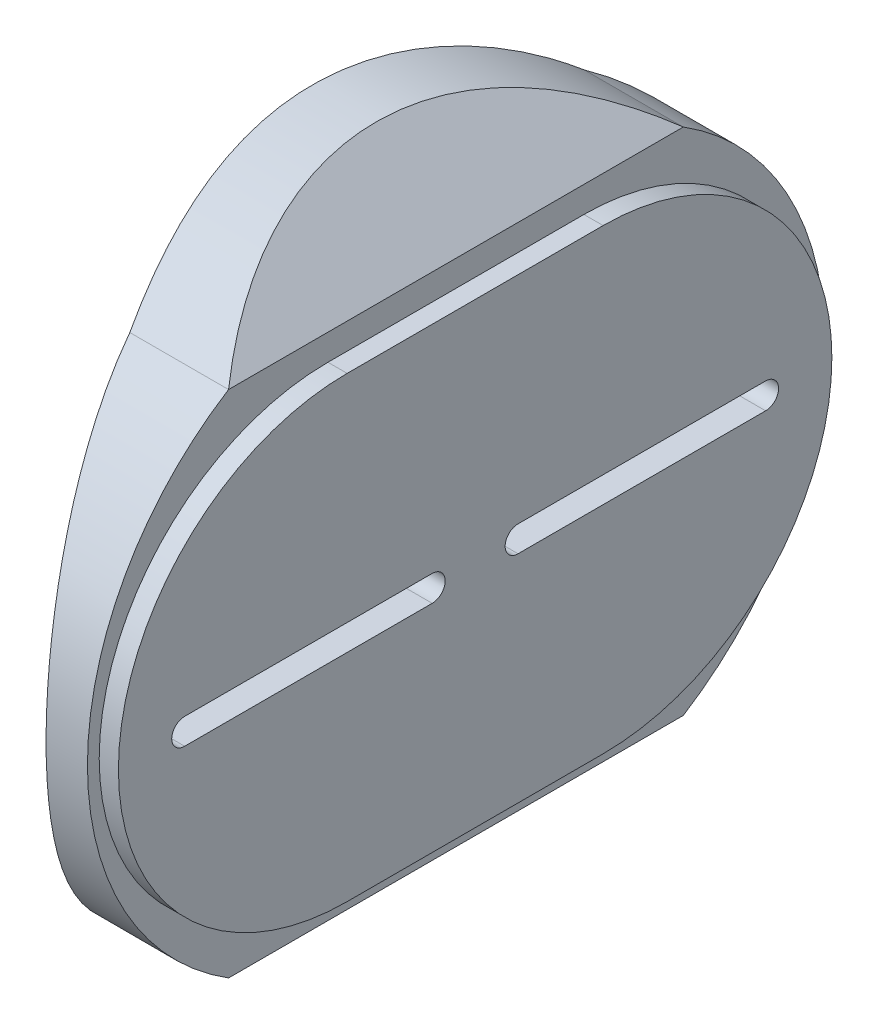
from build123d import *

# Parameters (mm, degrees)
BOSS_EXTRUDE1_DEPTH = 4.9
BOSS_EXTRUDE2_DEPTH = 35
CUT_EXTRUDE1_DEPTH  = 122.049617926
BOSS_EXTRUDE3_DEPTH = 40
SKETCH4_R           = 151.595087716
CUT_EXTRUDE2_DEPTH  = 211.164221503
CUT_EXTRUDE3_DEPTH  = 210.547521178


with BuildPart() as part:
    # Sketch1 → Boss-Extrude1 (new body)
    with BuildSketch(Plane(origin=(0, 0, 0), x_dir=(0, 0, -1), z_dir=(1, 0, 0))):
        with BuildLine():
            Line((-32.65, 58.35), (32.65, 58.35))
            ThreePointArc((32.65, 58.35), (91, 0), (32.65, -58.35))
            Line((32.65, -58.35), (-32.65, -58.35))
            ThreePointArc((-32.65, -58.35), (-91, 0), (-32.65, 58.35))
        make_face()
    extrude(amount=BOSS_EXTRUDE1_DEPTH)

    # Sketch3 → Boss-Extrude2 (add)
    with BuildSketch(Plane.ZY):
        with BuildLine():
            Line((-58, 65), (58, 65))
            ThreePointArc((58, 65), (94, 0), (58, -65))
            Line((58, -65), (-58, -65))
            ThreePointArc((-58, -65), (-94, 0), (-58, 65))
        make_face()
    extrude(amount=BOSS_EXTRUDE2_DEPTH)

    # Sketch2 → Cut-Extrude1 (cut, through all)
    with BuildSketch(Plane(origin=(4.9, 0, 0), x_dir=(0, 0, -1), z_dir=(1, 0, 0))):
        with BuildLine():
            Line((-10.95, -3.3), (-74.1, -3.3))
            ThreePointArc((-74.1, -3.3), (-77.4, 0), (-74.1, 3.3))
            Line((-74.1, 3.3), (-10.95, 3.3))
            ThreePointArc((-10.95, 3.3), (-7.65, 0), (-10.95, -3.3))
        make_face()
        with BuildLine():
            Line((10.95, 3.3), (74.1, 3.3))
            ThreePointArc((74.1, 3.3), (77.4, 0), (74.1, -3.3))
            Line((74.1, -3.3), (10.95, -3.3))
            ThreePointArc((10.95, -3.3), (7.65, 0), (10.95, 3.3))
        make_face()
    extrude(amount=-CUT_EXTRUDE1_DEPTH, mode=Mode.SUBTRACT)

    # Sketch5 → Boss-Extrude3 (add)
    with BuildSketch(Plane(origin=(0, -65, -58), x_dir=(0, 0, -1), z_dir=(1, 0, 0))):
        with BuildLine():
            Line((-116, 0), (0, 0))
            ThreePointArc((0, 0), (-58, -20), (-116, 0))
        make_face()
        with BuildLine():
            Line((-116, 130), (0, 130))
            ThreePointArc((0, 130), (-58, 150), (-116, 130))
        make_face()
    extrude(amount=-BOSS_EXTRUDE3_DEPTH)

    # Sketch4 → Cut-Extrude2 (cut, through all)
    with BuildSketch(Plane(origin=(0, 0, -94), x_dir=(-1, 0, 0), z_dir=(0, 0, -1))):
        with Locations((162.145087716, 0)):
            Circle(SKETCH4_R)
    extrude(amount=-CUT_EXTRUDE2_DEPTH, mode=Mode.SUBTRACT)

    # Sketch8 → Cut-Extrude3 (cut, through all)
    with BuildSketch(Plane(origin=(0, 0, -94), x_dir=(-1, 0, 0), z_dir=(0, 0, -1))):
        Polygon((0, 65), (0, 85), (20.321882247, 85), align=None)
        Polygon((0, -65), (0, -85), (20.321882247, -85), align=None)
    extrude(amount=-CUT_EXTRUDE3_DEPTH, mode=Mode.SUBTRACT)


solid = part.part
